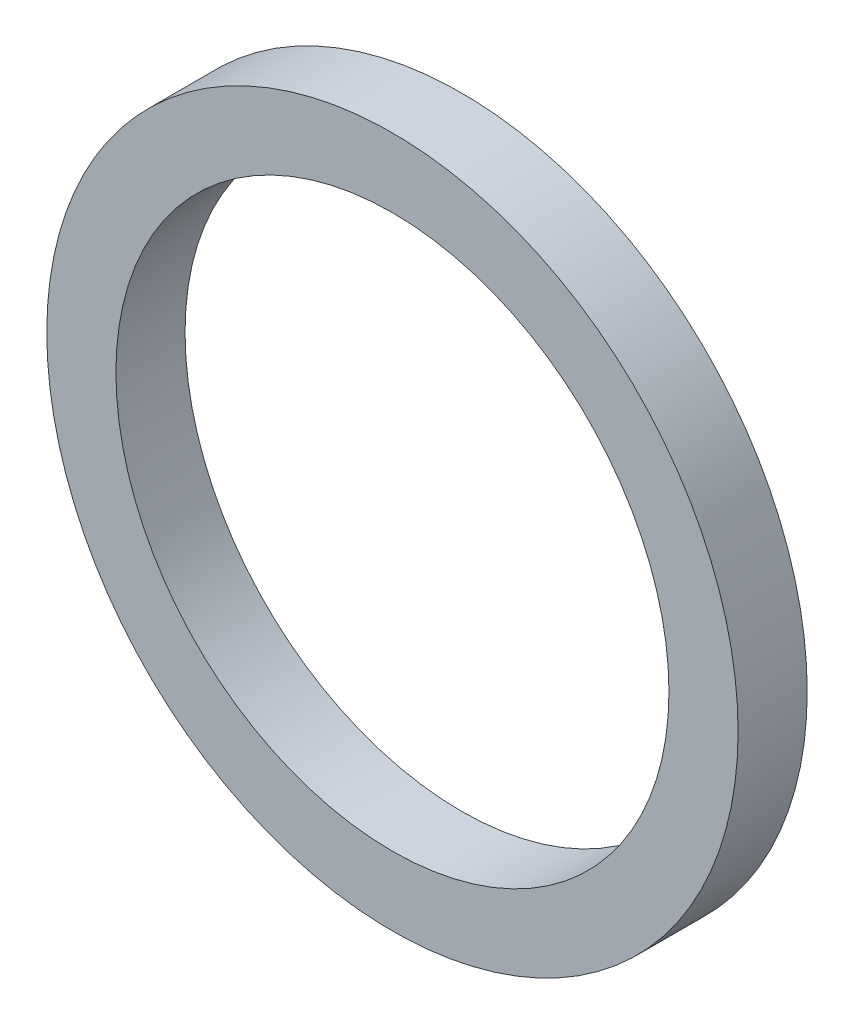
from build123d import *

# Parameters (mm, degrees)
SKETCH1_R           = 7.9375
SKETCH1_R_2         = 6.35
BOSS_EXTRUDE1_DEPTH = 1.5875


with BuildPart() as part:
    # Sketch1 → Boss-Extrude1 (new body)
    with BuildSketch(Plane.XY):
        Circle(SKETCH1_R)
        Circle(SKETCH1_R_2, mode=Mode.SUBTRACT)
    extrude(amount=BOSS_EXTRUDE1_DEPTH)


solid = part.part
